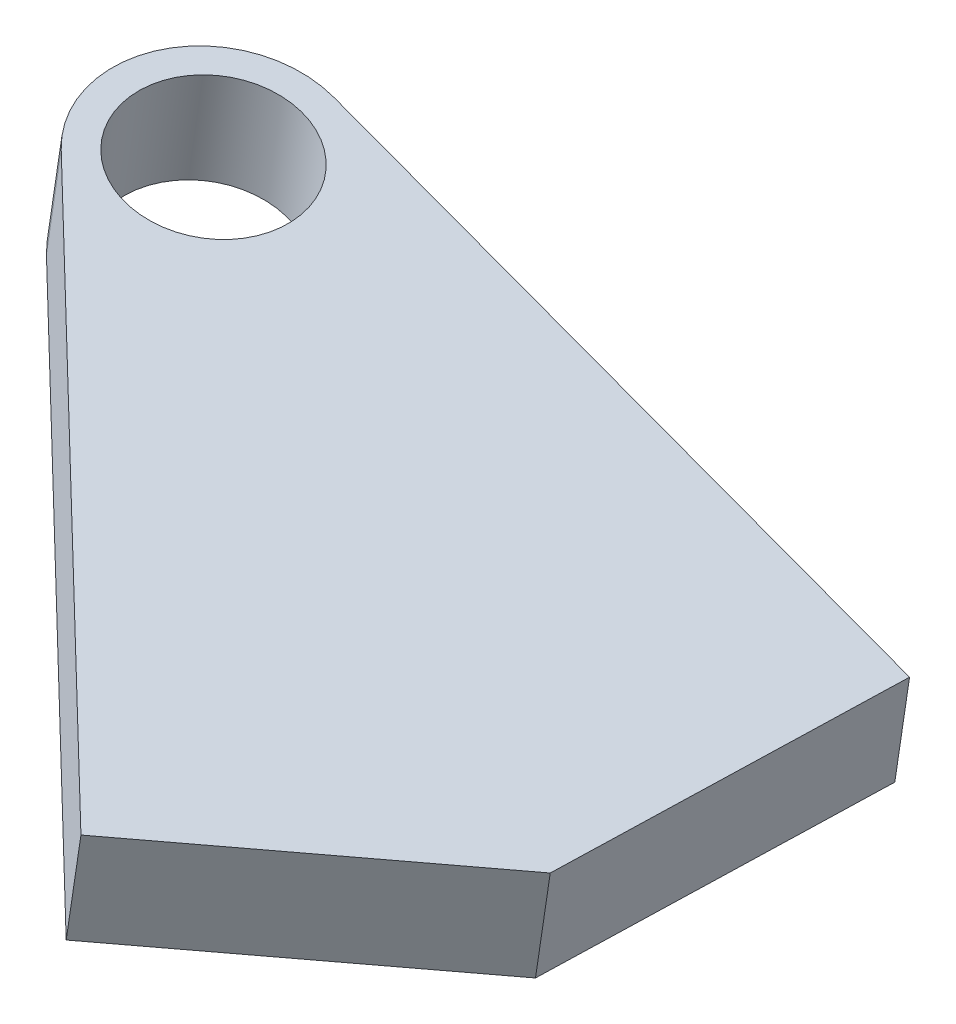
from build123d import *

# Parameters (mm, degrees)
BOSS_EXTRUDE1_DEPTH      = 3.175
BOSS_EXTRUDE1_DEPTH_BACK = 3.175
ROD_END_BLOCK_R          = 9.525
ROD_END_BLOCK_R_2        = 3.175
BOSS_EXTRUDE2_DEPTH      = 6.35
BOSS_EXTRUDE2_DEPTH_BACK = 6.35
SKETCH37_R               = 9.398


with BuildPart() as part:
    # rod end block → Boss-Extrude1 (new, two sides: drawn at the far end of the back side and taken through both)
    with BuildSketch(Plane(origin=(170.739381635, 0, -537.639710231), x_dir=(0.9530935317801348, 0, 0.3026759317799639), z_dir=(-0.3026759317799638, 0, 0.9530935317801347)).offset(-BOSS_EXTRUDE1_DEPTH_BACK)):
        with Locations((-735.226248284, 270)):
            Circle(ROD_END_BLOCK_R)
        with Locations((-735.226248284, 270)):
            Circle(ROD_END_BLOCK_R_2, mode=Mode.SUBTRACT)
    extrude(amount=BOSS_EXTRUDE1_DEPTH + BOSS_EXTRUDE1_DEPTH_BACK)


with BuildPart() as body_2:
    # Sketch37 → Boss-Extrude2 (new, two sides: drawn at the far end of the back side and taken through both)
    with BuildSketch(Plane(origin=(22.746911344, 108.672934845, 7.562045718), x_dir=(-0.9788870741818188, 0.20390872100911547, 0.014189062554840587), z_dir=(-0.2044018003828696, -0.9765257005314425, -0.06795189623415251)).offset(-BOSS_EXTRUDE2_DEPTH_BACK)):
        with BuildLine():
            Line((614.170295266, 816.013723782), (536.360328554, 806.277453435))
            Line((536.360328554, 806.277453435), (539.648481179, 767.278078165))
            Line((539.648481179, 767.278078165), (567.792401082, 740.080964501))
            Line((567.792401082, 740.080964501), (624.516091521, 794.22529775))
            ThreePointArc((624.516091521, 794.22529775), (627.2195154, 808.859423994), (614.170295266, 816.013723782))
        make_face()
        with Locations(Location((615.747134927, 803.411994668, 0), (0, 0, 180.814884333))):
            Circle(SKETCH37_R, mode=Mode.SUBTRACT)
    extrude(amount=BOSS_EXTRUDE2_DEPTH + BOSS_EXTRUDE2_DEPTH_BACK)


solid = Compound([part.part, body_2.part])
